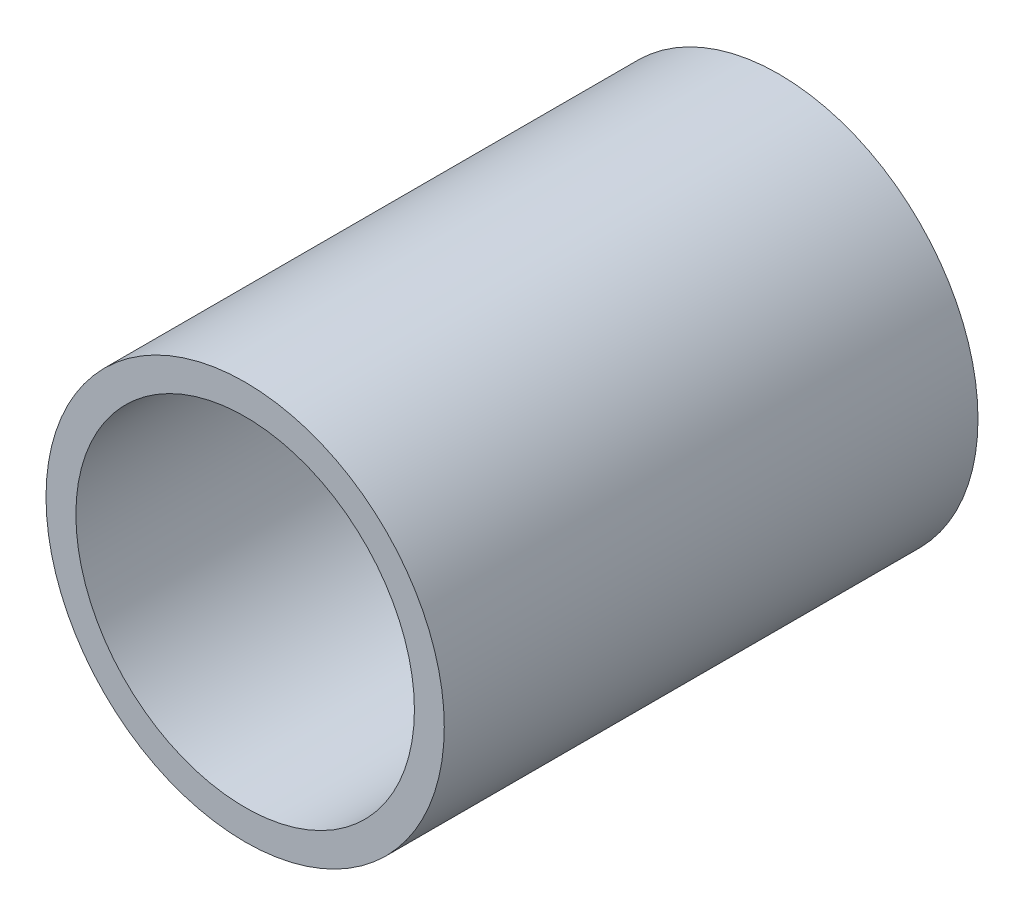
from build123d import *

# Parameters (mm, degrees)
SKETCH3_R           = 50
SKETCH3_R_2         = 42.5
BOSS_EXTRUDE1_DEPTH = 134


with BuildPart() as part:
    # Sketch3 → Boss-Extrude1 (new body)
    with BuildSketch(Plane.XY):
        Circle(SKETCH3_R)
        Circle(SKETCH3_R_2, mode=Mode.SUBTRACT)
    extrude(amount=BOSS_EXTRUDE1_DEPTH)


solid = part.part
